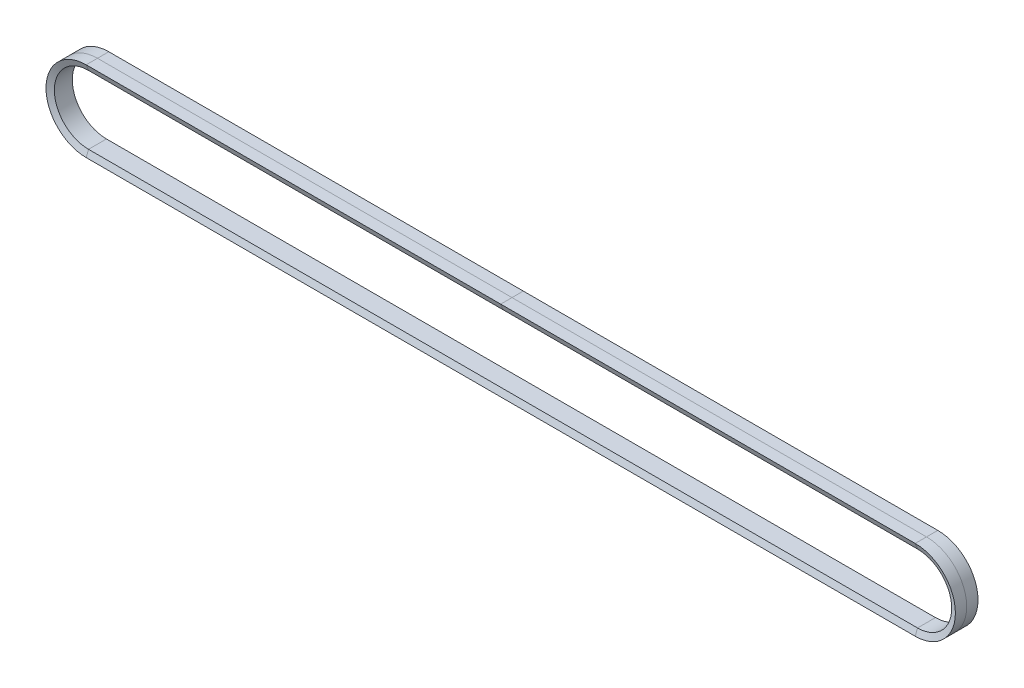
from build123d import *


with BuildPart() as part:
    # 扫描1: sweep along a path in 草图1
    with BuildLine(Plane.XY) as sweep_1_path:
        Line((165, -16), (-165, -16))
        ThreePointArc((-165, -16), (-181, 0), (-165, 16))
        Line((-165, 16), (165, 16))
        ThreePointArc((165, 16), (181, 0), (165, -16))
    # 草图2 → 扫描1 (sweep)
    with BuildSketch(Plane(origin=(0, 0, 0), x_dir=(0, 0, -1), z_dir=(1, 0, 0))):
        Polygon((0, 16), (4.5, 16), (3.570462231, 13.6), (-3.570462231, 13.6), (-4.5, 16), align=None)
    sweep(path=sweep_1_path.line)


solid = part.part
